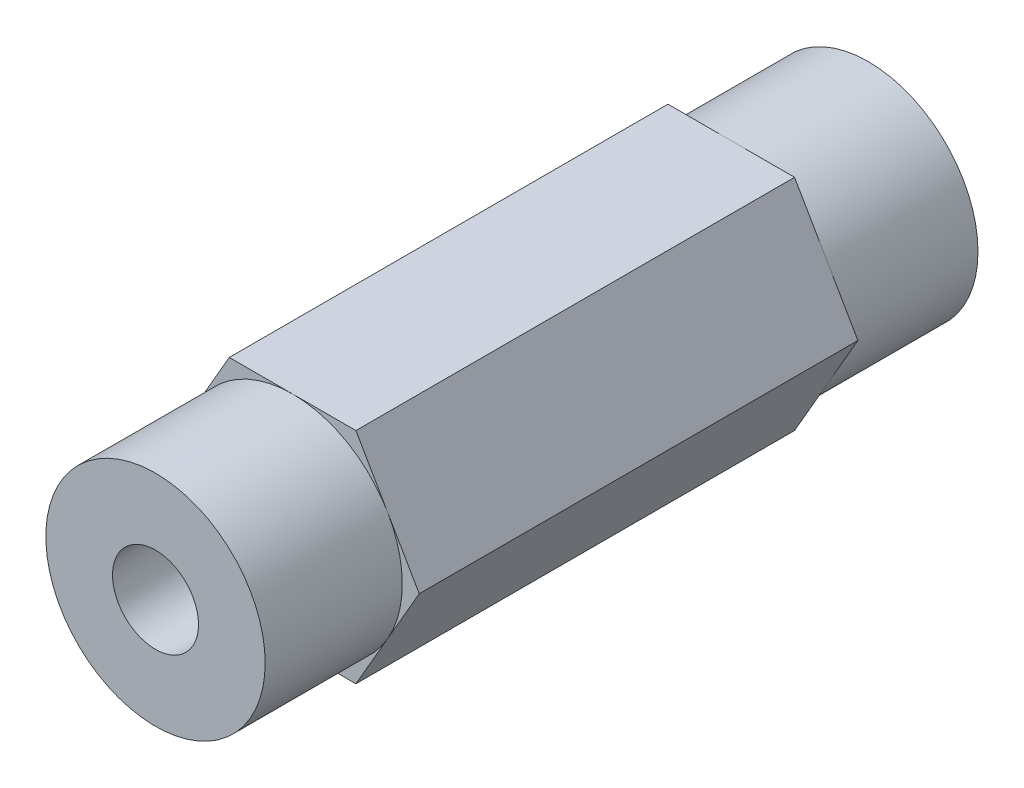
from build123d import *

# Parameters (mm, degrees)
SKETCH1_R           = 2.4892
BOSS_EXTRUDE1_DEPTH = 20.6375
SKETCH2_OUTSIDE_W   = 25.786
SKETCH2_OUTSIDE_H   = 23.822
SKETCH2_OUTSIDE_R   = 6.35
CUT_EXTRUDE4_DEPTH  = 7.9375


with BuildPart() as part:
    # Sketch1 → Boss-Extrude1 (new, symmetric)
    with BuildSketch(Plane.XY):
        Polygon((3.666174209, 6.35), (-3.666174209, 6.35), (-7.332348419, 0), (-3.666174209, -6.35), (3.666174209, -6.35), (7.332348419, 0), align=None)
        Circle(SKETCH1_R, mode=Mode.SUBTRACT)
    extrude(amount=BOSS_EXTRUDE1_DEPTH, both=True)

    # Sketch2 outside → Cut-Extrude4 (cut)
    with BuildSketch(Plane.XY.offset(20.6375)):
        Rectangle(SKETCH2_OUTSIDE_W, SKETCH2_OUTSIDE_H)
        Circle(SKETCH2_OUTSIDE_R, mode=Mode.SUBTRACT)
    cut_extrude4 = extrude(amount=-CUT_EXTRUDE4_DEPTH, mode=Mode.SUBTRACT)

    # Mirror1: Cut-Extrude4 across plane
    add(cut_extrude4.mirror(Plane.XY), mode=Mode.SUBTRACT)


solid = part.part
